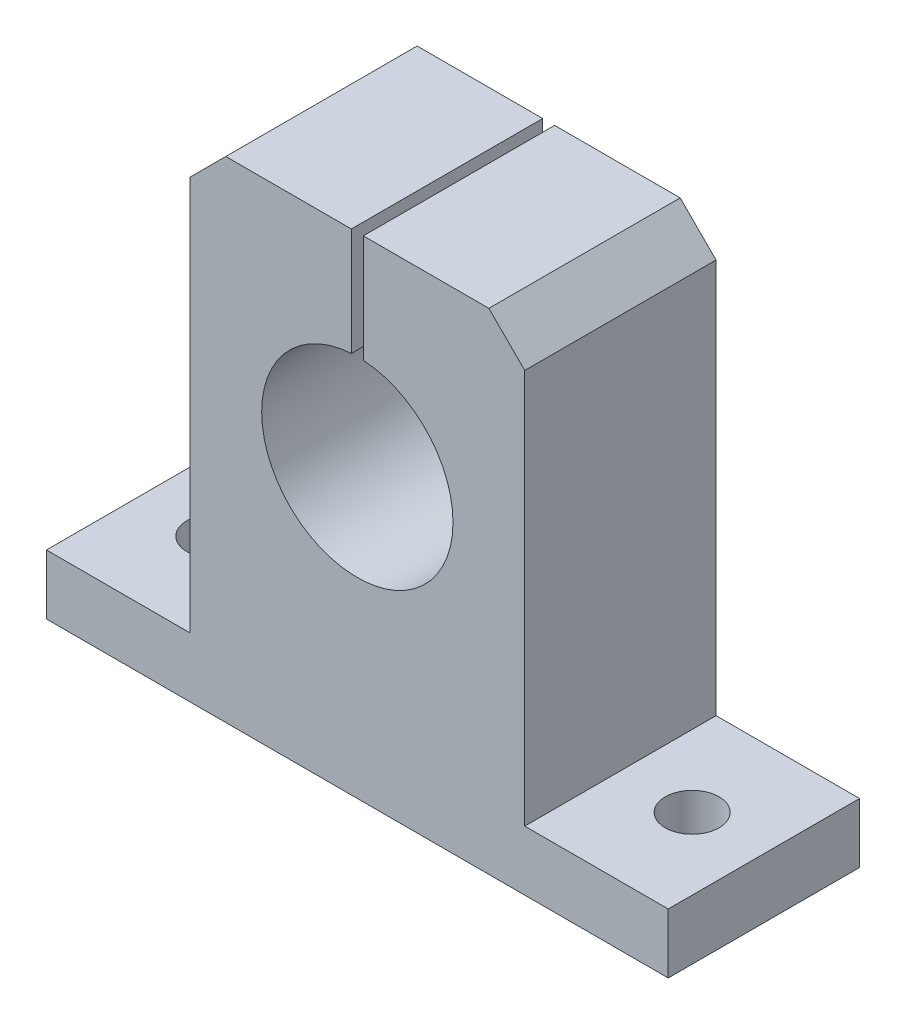
from build123d import *

# Parameters (mm, degrees)
EXTRUDE1_DEPTH          = 12.7
F_1_4_CLEARANCE_HOLE1_D = 7.14248
CHAMFER1_SIZE           = 4.7625


with BuildPart() as part:
    # Sketch1 → Extrude1 (new, symmetric)
    with BuildSketch(Plane.XY):
        with BuildLine():
            Line((22.225, 26.9875), (0.79375, 26.9875))
            Line((0.79375, 26.9875), (0.79375, 12.675171042))
            ThreePointArc((0.79375, 12.675171042), (0, -12.7), (-0.79375, 12.675171042))
            Line((-0.79375, 12.675171042), (-0.79375, 26.9875))
            Line((-0.79375, 26.9875), (-22.225, 26.9875))
            Line((-22.225, 26.9875), (-22.225, -30.1625))
            Line((-22.225, -30.1625), (-41.275, -30.1625))
            Line((-41.275, -30.1625), (-41.275, -38.1))
            Line((-41.275, -38.1), (41.275, -38.1))
            Line((41.275, -38.1), (41.275, -30.1625))
            Line((41.275, -30.1625), (22.225, -30.1625))
            Line((22.225, -30.1625), (22.225, 26.9875))
        make_face()
    extrude(amount=EXTRUDE1_DEPTH, both=True)

    # 1/4 Clearance Hole1 (through all)
    with Locations(Plane.XZ.offset(38.1)):
        with Locations((-31.75, 0), (31.75, 0)):
            Hole(F_1_4_CLEARANCE_HOLE1_D / 2)

    # Chamfer1
    chamfer1_edges = [part.edges().sort_by_distance(p)[0] for p in [
        (-22.225, 26.9875, 0),
        (22.225, 26.9875, 0),
    ]]
    chamfer(chamfer1_edges, length=CHAMFER1_SIZE)


solid = part.part
